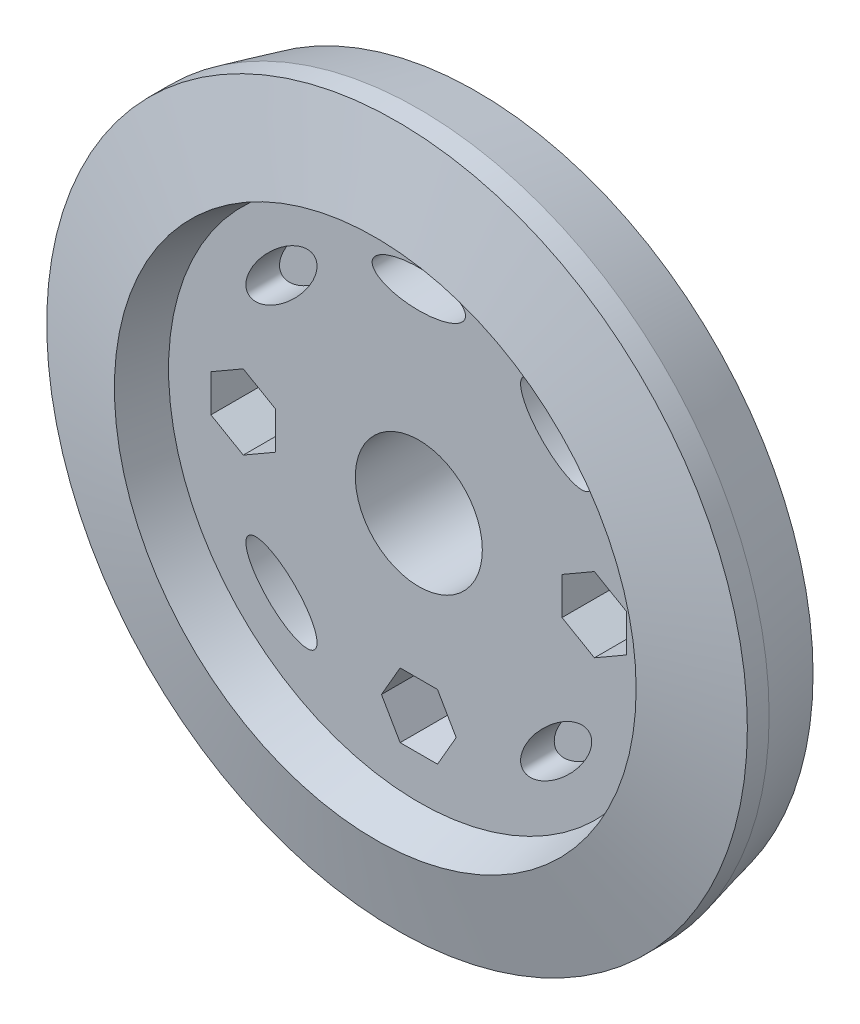
from build123d import *

# Parameters (mm, degrees)
SKETCH2_RX         = 317.5
SKETCH2_RY         = 127
CUT_EXTRUDE2_DEPTH = 228.6
CUT_EXTRUDE3_DEPTH = 3461.169664997


with BuildPart() as part:
    # Sketch1 → Revolve1 (revolve)
    with BuildSketch(Plane(origin=(0, 0, 0), x_dir=(0, 0, -1), z_dir=(1, 0, 0)), mode=Mode.PRIVATE) as revolve1_sk:
        Polygon((-394.866836272, 431.8), (394.866836272, 431.8), (394.866836272, 889), (0, 889), (0, 2286), (-394.866836272, 2382.130856714), (-542.941899874, 2382.130856714), (-691.016963476, 1773.898142535), (-394.866836272, 1701.8), align=None)
    revolve(revolve1_sk.sketch.rotate(Axis((0, 0, 0), (0, 0, -1)), 90), axis=Axis((0, 0, 0), (0, 0, -1)))

    # Sketch2 → Cut-Extrude2 (cut)
    with BuildSketch(Plane.XY.offset(394.866836272)):
        with Locations(Location((0, 1320.8), (0, 0, 180))):
            Ellipse(SKETCH2_RX, SKETCH2_RY)
        with Locations(Location((933.946636591, 933.946636591), (0, 0, 135))):
            Ellipse(SKETCH2_RX, SKETCH2_RY)
        with Locations(Location((933.946636591, -933.946636591), (0, 0, -135))):
            Ellipse(SKETCH2_RX, SKETCH2_RY)
        with Locations(Location((-933.946636591, -933.946636591), (0, 0, 135))):
            Ellipse(SKETCH2_RX, SKETCH2_RY)
        with Locations(Location((-933.946636591, 933.946636591), (0, 0, 45))):
            Ellipse(SKETCH2_RX, SKETCH2_RY)
    extrude(amount=-CUT_EXTRUDE2_DEPTH, mode=Mode.SUBTRACT)

    # Sketch3 → Cut-Extrude3 (cut, through all)
    with BuildSketch(Plane.XY.offset(394.866836272)):
        Polygon((254, -1193.8), (127, -973.829547439), (-127, -973.829547439), (-254, -1193.8), (-127, -1413.770452561), (127, -1413.770452561), align=None)
        Polygon((-1193.8, -254), (-973.829547439, -127), (-973.829547439, 127), (-1193.8, 254), (-1413.770452561, 127), (-1413.770452561, -127), align=None)
        Polygon((1193.8, 254), (973.829547439, 127), (973.829547439, -127), (1193.8, -254), (1413.770452561, -127), (1413.770452561, 127), align=None)
    extrude(amount=-CUT_EXTRUDE3_DEPTH, mode=Mode.SUBTRACT)


solid = part.part
